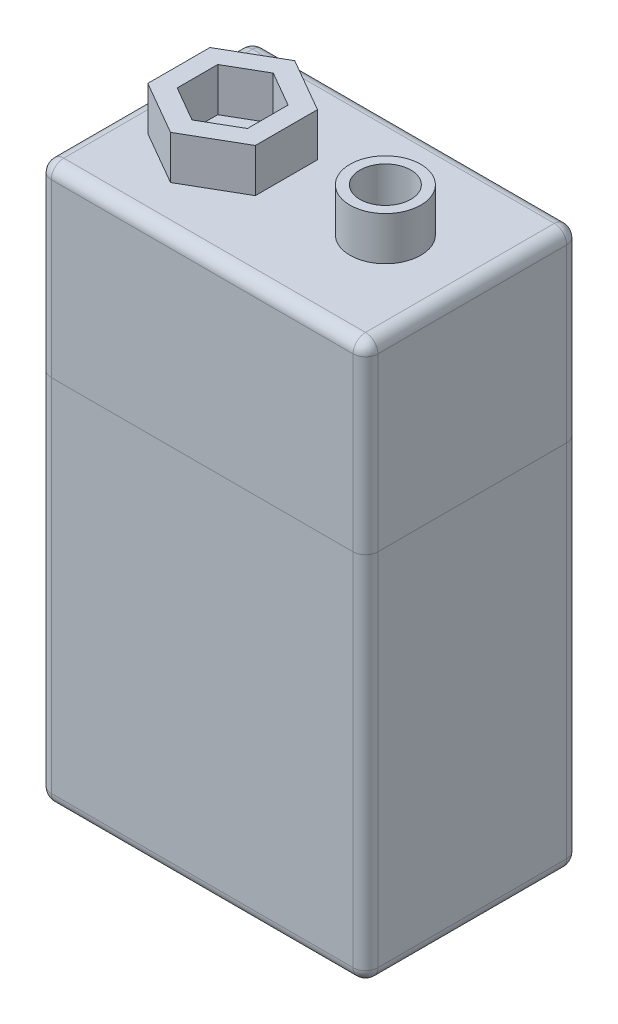
from build123d import *

# Parameters (mm, degrees)
CROQUIS1_W                = 26.3
CROQUIS1_H                = 44.8
SALIENTE_EXTRUIR1_DEPTH   = 17.2
REDONDEO1_R               = 1
CROQUIS3_R                = 2.85
CROQUIS3_R_2              = 2.05
SALIENTE_EXTRUIR2_DEPTH   = 3.5
SALIENTE_EXTRUIR2_2_DEPTH = 3.5


with BuildPart() as part:
    # Croquis1 → Saliente-Extruir1 (new body)
    with BuildSketch(Plane.XY):
        Rectangle(CROQUIS1_W, CROQUIS1_H)
    extrude(amount=SALIENTE_EXTRUIR1_DEPTH)

    # Redondeo1
    redondeo1_edges = [part.edges().sort_by_distance(p)[0] for p in [
        (-13.15, 0, 17.2),
        (0, -22.4, 17.2),
        (13.15, 0, 17.2),
        (0, -22.4, 0),
        (-13.15, 0, 0),
        (0, 22.4, 0),
        (13.15, 0, 0),
        (13.15, -22.4, 8.6),
        (-13.15, -22.4, 8.6),
        (-13.15, 22.4, 8.6),
        (13.15, 22.4, 8.6),
        (0, 22.4, 17.2),
    ]]
    fillet(redondeo1_edges, radius=REDONDEO1_R)


with BuildPart() as body_2:
    # Croquis3 → Saliente-Extruir2 (new body)
    with BuildSketch(Plane(origin=(0, 22.4, 0), x_dir=(1, 0, 0), z_dir=(0, 1, 0))):
        with Locations(Location((6.15, -8.6, 0), (0, 0, 270))):
            Circle(CROQUIS3_R)
        with Locations(Location((6.15, -8.6, 0), (0, 0, 270))):
            Circle(CROQUIS3_R_2, mode=Mode.SUBTRACT)
    extrude(amount=SALIENTE_EXTRUIR2_DEPTH)


with BuildPart() as body_3:
    # Croquis3 → Saliente-Extruir2 2 (new body)
    with BuildSketch(Plane(origin=(0, 22.4, 0), x_dir=(1, 0, 0), z_dir=(0, 1, 0))):
        Polygon((-1.819872981, -11.1), (-1.819872981, -6.1), (-6.15, -3.6), (-10.480127019, -6.1), (-10.480127019, -11.1), (-6.15, -13.6), align=None)
        Polygon((-3.319872981, -6.966025404), (-6.15, -5.332050808), (-8.980127019, -6.966025404), (-8.980127019, -10.233974596), (-6.15, -11.867949192), (-3.319872981, -10.233974596), align=None, mode=Mode.SUBTRACT)
    extrude(amount=SALIENTE_EXTRUIR2_2_DEPTH)


solid = Compound([part.part, body_2.part, body_3.part])
